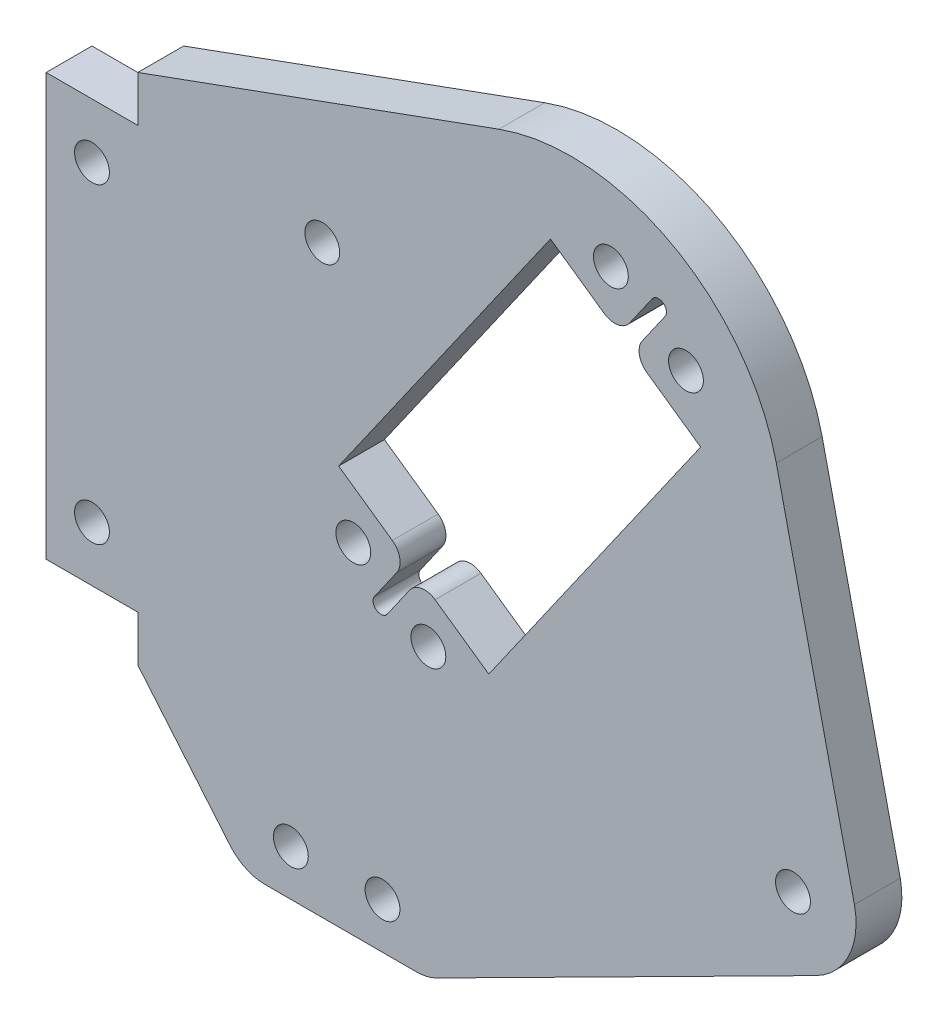
from build123d import *

# Parameters (mm, degrees)
ESQUISSE1_R        = 1.9
BOSS_EXTRU_1_DEPTH = 5


with BuildPart() as part:
    # Esquisse1 → Boss.-Extru.1 (new body)
    with BuildSketch(Plane.XY):
        with BuildLine():
            Line((40.548338426, -21.276277818), (-0.975727052, -42.264773686))
            ThreePointArc((-0.975727052, -42.264773686), (-2.030907408, -42.633295828), (-3.141586831, -42.758217285))
            Line((-3.141586831, -42.758217285), (-19.618188193, -42.758217285))
            ThreePointArc((-19.618188193, -42.758217285), (-21.685859542, -42.310660648), (-23.383370665, -41.048112535))
            Line((-23.383370665, -41.048112535), (-33.519906154, -28.967859949))
            Line((-33.519906154, -28.967859949), (-33.519906154, -23.969415955))
            Line((-33.519906154, -23.969415955), (-43.519906154, -23.969415955))
            Line((-43.519906154, -23.969415955), (-43.519906154, 22.030584045))
            Line((-43.519906154, 22.030584045), (-33.519906154, 22.030584045))
            Line((-33.519906154, 22.030584045), (-33.519906154, 27.030582734))
            Line((-33.519906154, 27.030582734), (5.8804708, 41.371147503))
            ThreePointArc((5.8804708, 41.371147503), (24.71028401, 39.977143129), (36.151646844, 24.957145453))
            Line((36.151646844, 24.957145453), (44.672795688, -12.50542283))
            ThreePointArc((44.672795688, -12.50542283), (44.089997655, -17.586546272), (40.548338426, -21.276277818))
        make_face()
        with Locations((37.968513549, -14.646168575)):
            Circle(ESQUISSE1_R, mode=Mode.SUBTRACT)
        with Locations((26.290921771, 28.768039745)):
            Circle(ESQUISSE1_R, mode=Mode.SUBTRACT)
        with Locations((18.099401328, 34.503804109)):
            Circle(ESQUISSE1_R, mode=Mode.SUBTRACT)
        with Locations((-1.81432361, -11.370410425)):
            Circle(ESQUISSE1_R, mode=Mode.SUBTRACT)
        with Locations((-10.005844053, -5.634646061)):
            Circle(ESQUISSE1_R, mode=Mode.SUBTRACT)
        with Locations((-13.38853652, 21.030583318)):
            Circle(ESQUISSE1_R, mode=Mode.SUBTRACT)
        with Locations((-6.818359545, -37.758216658)):
            Circle(ESQUISSE1_R, mode=Mode.SUBTRACT)
        with Locations((-16.818359545, -37.758216658)):
            Circle(ESQUISSE1_R, mode=Mode.SUBTRACT)
        with Locations((-38.519906154, -17.969415955)):
            Circle(ESQUISSE1_R, mode=Mode.SUBTRACT)
        with Locations((-38.519906154, 16.030584045)):
            Circle(ESQUISSE1_R, mode=Mode.SUBTRACT)
        with BuildLine():
            Line((21.617307412, 29.328732493), (24.05500749, 32.810128977))
            ThreePointArc((24.05500749, 32.810128977), (23.766600359, 33.932469516), (22.625252159, 33.732091761))
            Line((22.625252159, 33.732091761), (20.187552449, 30.250695803))
            ThreePointArc((20.187552449, 30.250695803), (18.892160946, 29.381199086), (17.366350313, 29.706722658))
            Line((17.366350313, 29.706722658), (11.508582376, 33.808377058))
            Line((11.508582376, 33.808377058), (-11.606548602, 0.796549047))
            Line((-11.606548602, 0.796549047), (-5.749613357, -3.304522496))
            ThreePointArc((-5.749613357, -3.304522496), (-4.927150936, -4.595530225), (-5.258462389, -6.089979325))
            Line((-5.258462389, -6.089979325), (-7.696162511, -9.571375872))
            ThreePointArc((-7.696162511, -9.571375872), (-7.487422906, -10.755197269), (-6.303601509, -10.546457664))
            Line((-6.303601509, -10.546457664), (-3.865901833, -7.065061754))
            ThreePointArc((-3.865901833, -7.065061754), (-2.574894061, -6.242599111), (-1.080444801, -6.573910562))
            Line((-1.080444801, -6.573910562), (4.776491193, -10.67498149))
            Line((4.776491193, -10.67498149), (27.891620971, 22.336844808))
            Line((27.891620971, 22.336844808), (22.031293977, 26.440291454))
            ThreePointArc((22.031293977, 26.440291454), (21.198678089, 27.79484445), (21.617307412, 29.328732493))
        make_face(mode=Mode.SUBTRACT)
    extrude(amount=BOSS_EXTRU_1_DEPTH)


solid = part.part
